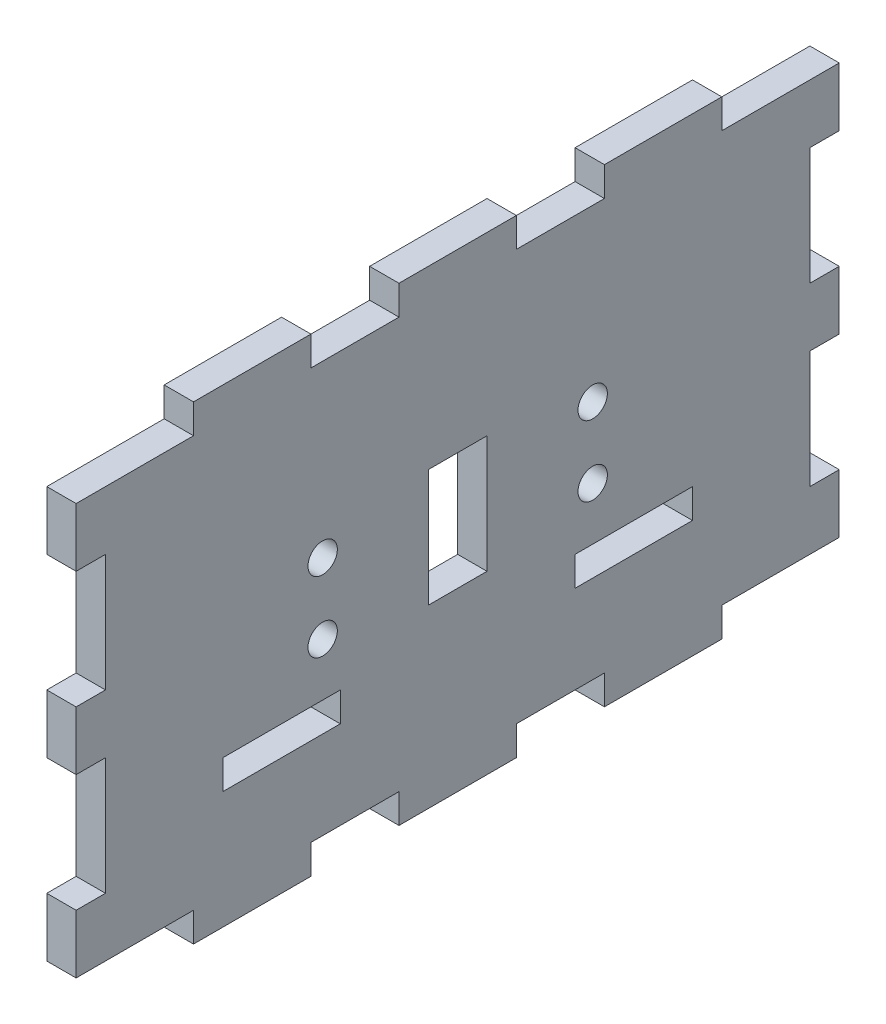
from build123d import *

# Parameters (mm, degrees)
BOSS_EXTRUDE1_DEPTH = 5
SKETCH2_R           = 2.5
SKETCH2_W           = 10
SKETCH2_H           = 20
CUT_EXTRUDE1_DEPTH  = 5
SKETCH3_W           = 20
SKETCH3_H           = 5
CUT_EXTRUDE2_DEPTH  = 5


with BuildPart() as part:
    # Sketch1 → Boss-Extrude1 (new body)
    with BuildSketch(Plane(origin=(0, 0, 0), x_dir=(0, 0, -1), z_dir=(1, 0, 0))):
        Polygon((65, 35), (65, 25), (60, 25), (60, 5), (65, 5), (65, -5), (60, -5), (60, -25), (65, -25), (65, -35), (60, -35), (45, -35), (45, -40), (25, -40), (25, -35), (10, -35), (10, -40), (-10, -40), (-10, -35), (-25, -35), (-25, -40), (-45, -40), (-45, -35), (-60, -35), (-65, -35), (-65, -25), (-60, -25), (-60, -5), (-65, -5), (-65, 5), (-60, 5), (-60, 25), (-65, 25), (-65, 35), (-60, 35), (-45, 35), (-45, 40), (-25, 40), (-25, 35), (-10, 35), (-10, 40), (10, 40), (10, 35), (25, 35), (25, 40), (45, 40), (45, 35), (60, 35), align=None)
    extrude(amount=BOSS_EXTRUDE1_DEPTH)

    # Sketch2 → Cut-Extrude1 (cut)
    with BuildSketch(Plane(origin=(0, 0, 0), x_dir=(0, 0, -1), z_dir=(1, 0, 0))):
        with Locations((23, 6)):
            Circle(SKETCH2_R)
        with Locations(Location((23, -6, 0), (0, 0, 180))):
            Circle(SKETCH2_R)
        with Locations((-23, -6)):
            Circle(SKETCH2_R)
        with Locations(Location((-23, 6, 0), (0, 0, 180))):
            Circle(SKETCH2_R)
        Rectangle(SKETCH2_W, SKETCH2_H)
    extrude(amount=CUT_EXTRUDE1_DEPTH, mode=Mode.SUBTRACT)

    # Sketch3 → Cut-Extrude2 (cut)
    with BuildSketch(Plane(origin=(5, 0, 0), x_dir=(0, 0, -1), z_dir=(1, 0, 0))):
        with Locations((30, -17.5)):
            Rectangle(SKETCH3_W, SKETCH3_H)
        with Locations((-30, -17.5)):
            Rectangle(SKETCH3_W, SKETCH3_H)
    extrude(amount=-CUT_EXTRUDE2_DEPTH, mode=Mode.SUBTRACT)


solid = part.part
